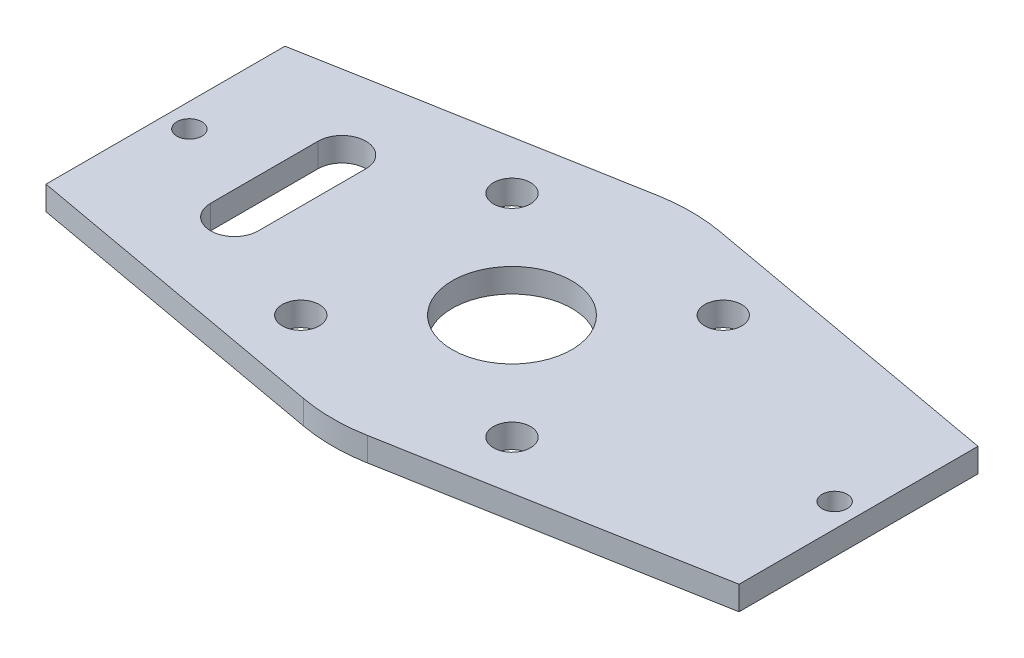
from build123d import *

# Parameters (mm, degrees)
SKETCH1_R           = 5
SKETCH1_R_2         = 1.05
SKETCH1_R_3         = 1.55
BOSS_EXTRUDE1_DEPTH = 2


with BuildPart() as part:
    # Sketch1 → Boss-Extrude1 (new body)
    with BuildSketch(Plane(origin=(0, 0, 0), x_dir=(1, 0, 0), z_dir=(0, 1, 0))):
        with BuildLine():
            Line((-2.668728536, 14.760687247), (-29, 10))
            Line((-29, 10), (-29, -10))
            Line((-29, -10), (-2.668728536, -14.760687247))
            ThreePointArc((-2.668728536, -14.760687247), (0, -15), (2.668728536, -14.760687247))
            Line((2.668728536, -14.760687247), (29, -10))
            Line((29, -10), (29, 10))
            Line((29, 10), (2.668728536, 14.760687247))
            ThreePointArc((2.668728536, 14.760687247), (0, 15), (-2.668728536, 14.760687247))
        make_face()
        with Locations(Location((0, 0, 0), (0, 0, 270))):
            Circle(SKETCH1_R, mode=Mode.SUBTRACT)
        with Locations(Location((-27, 0, 0), (0, 0, 270))):
            Circle(SKETCH1_R_2, mode=Mode.SUBTRACT)
        with Locations(Location((27, 0, 0), (0, 0, 270))):
            Circle(SKETCH1_R_2, mode=Mode.SUBTRACT)
        with Locations(Location((8.838834765, 8.838834765, 0), (0, 0, 270))):
            Circle(SKETCH1_R_3, mode=Mode.SUBTRACT)
        with Locations(Location((8.838834765, -8.838834765, 0), (0, 0, 270))):
            Circle(SKETCH1_R_3, mode=Mode.SUBTRACT)
        with Locations(Location((-8.838834765, -8.838834765, 0), (0, 0, 270))):
            Circle(SKETCH1_R_3, mode=Mode.SUBTRACT)
        with Locations(Location((-8.838834765, 8.838834765, 0), (0, 0, 270))):
            Circle(SKETCH1_R_3, mode=Mode.SUBTRACT)
        with BuildLine():
            Line((-20.728140636, -4.5), (-20.728140636, 4.5))
            ThreePointArc((-20.728140636, 4.5), (-18.728140636, 6.5), (-16.728140636, 4.5))
            Line((-16.728140636, 4.5), (-16.728140636, -4.5))
            ThreePointArc((-16.728140636, -4.5), (-18.728140636, -6.5), (-20.728140636, -4.5))
        make_face(mode=Mode.SUBTRACT)
    extrude(amount=BOSS_EXTRUDE1_DEPTH)


solid = part.part
